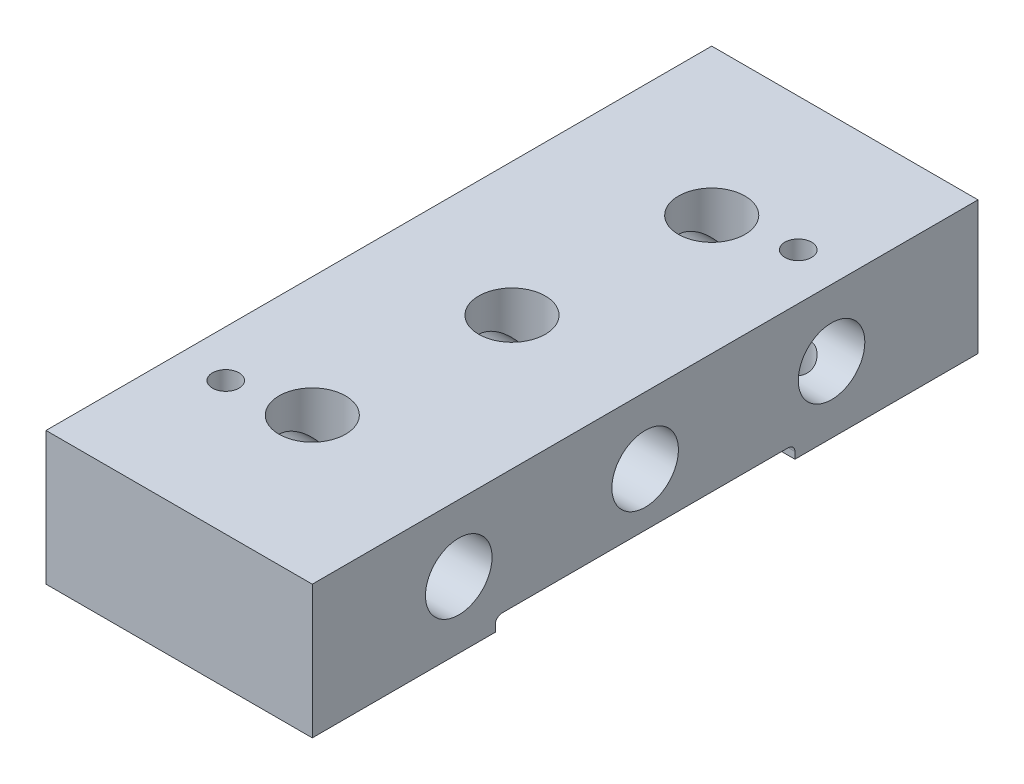
from build123d import *

# Parameters (mm, degrees)
ESQUISSE1_W             = 20
ESQUISSE1_H             = 50
ESQUISSE1_R             = 2.5
ESQUISSE1_R_2           = 1
BOSS_EXTRU_1_DEPTH      = 10
ESQUISSE2_R             = 2.5
ENL_V_MAT_EXTRU_1_DEPTH = 55.772255751
ENL_V_MAT_EXTRU_2_DEPTH = 41.175091243


with BuildPart() as part:
    # Esquisse1 → Boss.-Extru.1 (new body)
    with BuildSketch(Plane(origin=(0, 0, 0), x_dir=(1, 0, 0), z_dir=(0, 1, 0))):
        with Locations((10, 25)):
            Rectangle(ESQUISSE1_W, ESQUISSE1_H)
        with Locations(Location((10, 25, 0), (0, 0, 270))):
            Circle(ESQUISSE1_R, mode=Mode.SUBTRACT)
        with Locations(Location((11, 39, 0), (0, 0, 270))):
            Circle(ESQUISSE1_R, mode=Mode.SUBTRACT)
        with Locations(Location((9, 11, 0), (0, 0, 270))):
            Circle(ESQUISSE1_R, mode=Mode.SUBTRACT)
        with Locations(Location((16.5, 40, 0), (0, 0, 270))):
            Circle(ESQUISSE1_R_2, mode=Mode.SUBTRACT)
        with Locations(Location((3.5, 10, 0), (0, 0, 270))):
            Circle(ESQUISSE1_R_2, mode=Mode.SUBTRACT)
    extrude(amount=BOSS_EXTRU_1_DEPTH)

    # Esquisse2 → Enlèv. mat.-Extru.1 (cut, through all)
    with BuildSketch(Plane(origin=(20, 0, 0), x_dir=(0, 0, -1), z_dir=(1, 0, 0))):
        with Locations((11, 5)):
            Circle(ESQUISSE2_R)
        with Locations((25, 5)):
            Circle(ESQUISSE2_R)
        with Locations((39, 5)):
            Circle(ESQUISSE2_R)
    extrude(amount=-ENL_V_MAT_EXTRU_1_DEPTH, mode=Mode.SUBTRACT)

    # Esquisse3 → Enlèv. mat.-Extru.2 (cut, through all)
    with BuildSketch(Plane(origin=(0, -14.270103986, -25), x_dir=(0, 0, 1), z_dir=(-1, 0, 0))):
        with BuildLine():
            Line((-11.25, 14.270103986), (11.25, 14.270103986))
            Line((11.25, 14.270103986), (11.25, 14.770103986))
            ThreePointArc((11.25, 14.770103986), (11.103553391, 15.123657377), (10.75, 15.270103986))
            Line((10.75, 15.270103986), (-10.75, 15.270103986))
            ThreePointArc((-10.75, 15.270103986), (-11.103553391, 15.123657377), (-11.25, 14.770103986))
            Line((-11.25, 14.770103986), (-11.25, 14.270103986))
        make_face()
    extrude(amount=-ENL_V_MAT_EXTRU_2_DEPTH, mode=Mode.SUBTRACT)


solid = part.part
